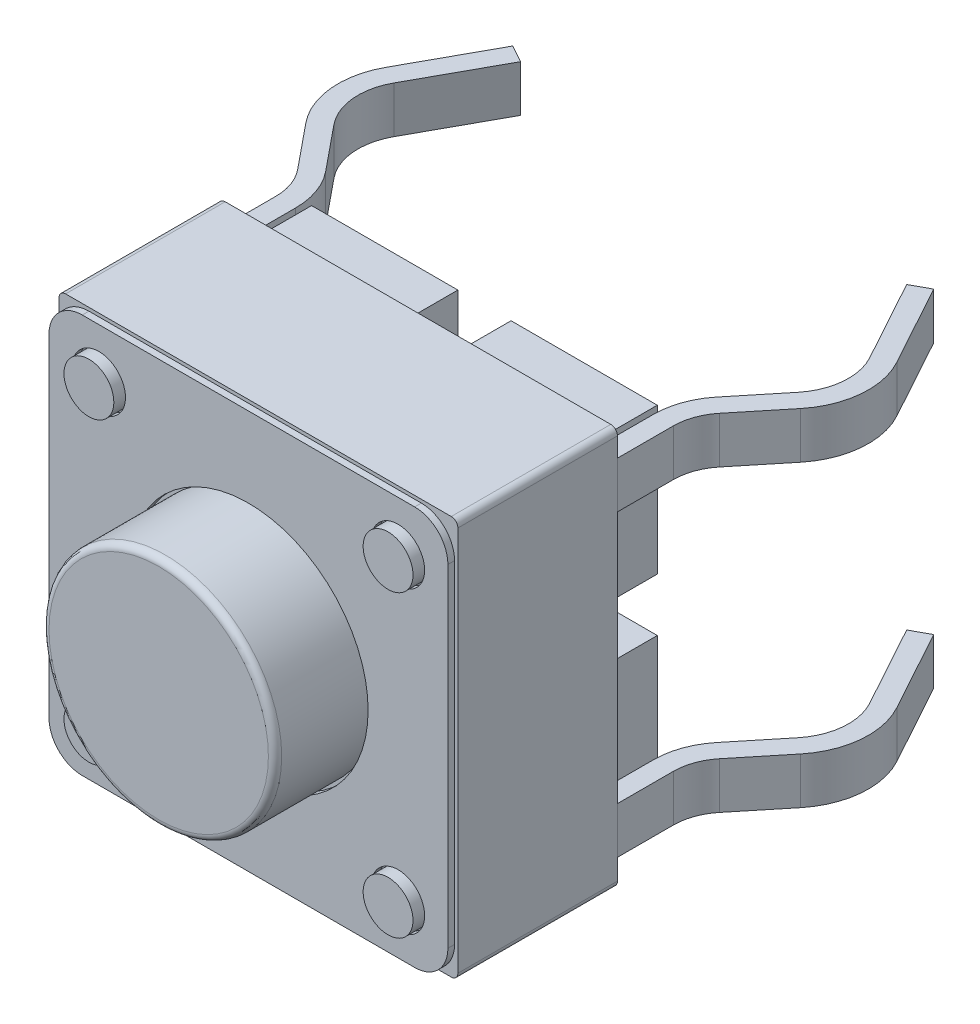
from build123d import *

# Parameters (mm, degrees)
SKETCH_1_W          = 6
SKETCH_1_H          = 6
EXTRUDE_1_DEPTH     = 3.4
SKETCH_2_W          = 6
SKETCH_2_H          = 6
SKETCH_2_W_2        = 2.2
SKETCH_2_H_2        = 2.2
CUT_EXTRUDE_1_DEPTH = 1
EXTRUDE_START       = 0.05
SKETCH_3_R          = 0.4
SKETCH_3_R_2        = 1.8
EXTRUDE_2_DEPTH     = 0.1
SKETCH_4_R          = 1.75
EXTRUDE_3_DEPTH     = 1.5
SKETCH_4_3_R        = 0.375
EXTRUDE_4_DEPTH     = 0.3
SKETCH_7_W          = 0.3
SKETCH_7_H          = 0.7
FILLET_1_R          = 0.1


with BuildPart() as part:
    # Эскиз1 → Бобышка-Вытянуть1 (new body)
    with BuildSketch(Plane.XY):
        with Locations((3, 3)):
            Rectangle(SKETCH_1_W, SKETCH_1_H)
    extrude(amount=EXTRUDE_1_DEPTH)

    # Эскиз2 → Вырез-Вытянуть1 (cut)
    with BuildSketch(Plane(origin=(0, 0, 0), x_dir=(-1, 0, 0), z_dir=(0, 0, -1))):
        with Locations((-3, 3)):
            Rectangle(SKETCH_2_W, SKETCH_2_H)
        with Locations((-1.5, 4.5)):
            Rectangle(SKETCH_2_W_2, SKETCH_2_H_2, mode=Mode.SUBTRACT)
        with Locations((-4.5, 4.5)):
            Rectangle(SKETCH_2_W_2, SKETCH_2_H_2, mode=Mode.SUBTRACT)
        with Locations((-1.5, 1.5)):
            Rectangle(SKETCH_2_W_2, SKETCH_2_H_2, mode=Mode.SUBTRACT)
        with Locations((-4.5, 1.5)):
            Rectangle(SKETCH_2_W_2, SKETCH_2_H_2, mode=Mode.SUBTRACT)
    extrude(amount=-CUT_EXTRUDE_1_DEPTH, mode=Mode.SUBTRACT)

    # Эскиз4 → Бобышка-Вытянуть3 (add)
    with BuildSketch(Plane.XY.offset(3.4)):
        with Locations((3, 3)):
            Circle(SKETCH_4_R)
    extrude(amount=EXTRUDE_3_DEPTH)

    # Эскиз4<3> → Бобышка-Вытянуть4 (add)
    with BuildSketch(Plane.XY.offset(3.4)):
        with Locations((0.75, 5.25)):
            Circle(SKETCH_4_3_R)
        with Locations((5.25, 5.25)):
            Circle(SKETCH_4_3_R)
        with Locations((5.25, 0.75)):
            Circle(SKETCH_4_3_R)
        with Locations((0.75, 0.75)):
            Circle(SKETCH_4_3_R)
    extrude(amount=EXTRUDE_4_DEPTH)

    # По траектории1: sweep along a path in Эскиз5
    with BuildLine(Plane.XZ) as sweep_1_path:
        Line((0.2, 1), (0.2, 0.15026769))
        ThreePointArc((0.2, 0.15026769), (0.142091529, -0.185088166), (-0.0249271, -0.481604132))
        Line((-0.0249271, -0.481604132), (-0.574247112, -1.155416509))
        ThreePointArc((-0.574247112, -1.155416509), (-0.795032605, -1.696370452), (-0.675854547, -2.268361705))
        Line((-0.675854547, -2.268361705), (0, -3.5))
    # Эскиз7 → По траектории1 (sweep)
    with BuildSketch(Plane(origin=(0, 0, 1), x_dir=(-1, 0, 0), z_dir=(0, 0, -1))):
        with Locations((-0.16, 0.75)):
            Rectangle(SKETCH_7_W, SKETCH_7_H)
        with Locations((-0.16, 5.25)):
            Rectangle(SKETCH_7_W, SKETCH_7_H)
    sweep_1 = sweep(path=sweep_1_path.line)

    # Зеркальное отражение1: По траектории1 across plane
    add(sweep_1.mirror(Plane.ZY.offset(-3)))

    # Скругление1
    fillet_1_edges = [part.edges().sort_by_distance(p)[0] for p in [
        (1.25, 3, 4.9),
        (6, 6, 2.2),
        (6, 0, 2.2),
        (0, 0, 2.2),
        (0, 6, 2.2),
    ]]
    fillet(fillet_1_edges, radius=FILLET_1_R)


with BuildPart() as body_2:
    # Эскиз3 → Бобышка-Вытянуть2 (new body)
    with BuildSketch(Plane.XY.offset(3.4).offset(EXTRUDE_START)):
        with BuildLine():
            Line((0.5, 0), (5.5, 0))
            ThreePointArc((5.5, 0), (5.853553391, 0.146446609), (6, 0.5))
            Line((6, 0.5), (6, 5.5))
            ThreePointArc((6, 5.5), (5.853553391, 5.853553391), (5.5, 6))
            Line((5.5, 6), (0.5, 6))
            ThreePointArc((0.5, 6), (0.146446609, 5.853553391), (0, 5.5))
            Line((0, 5.5), (0, 0.5))
            ThreePointArc((0, 0.5), (0.146446609, 0.146446609), (0.5, 0))
        make_face()
        with Locations((0.75, 5.25)):
            Circle(SKETCH_3_R, mode=Mode.SUBTRACT)
        with Locations((5.25, 5.25)):
            Circle(SKETCH_3_R, mode=Mode.SUBTRACT)
        with Locations((5.25, 0.75)):
            Circle(SKETCH_3_R, mode=Mode.SUBTRACT)
        with Locations((0.75, 0.75)):
            Circle(SKETCH_3_R, mode=Mode.SUBTRACT)
        with Locations((3, 3)):
            Circle(SKETCH_3_R_2, mode=Mode.SUBTRACT)
    extrude(amount=EXTRUDE_2_DEPTH)


solid = Compound([part.part, body_2.part])
